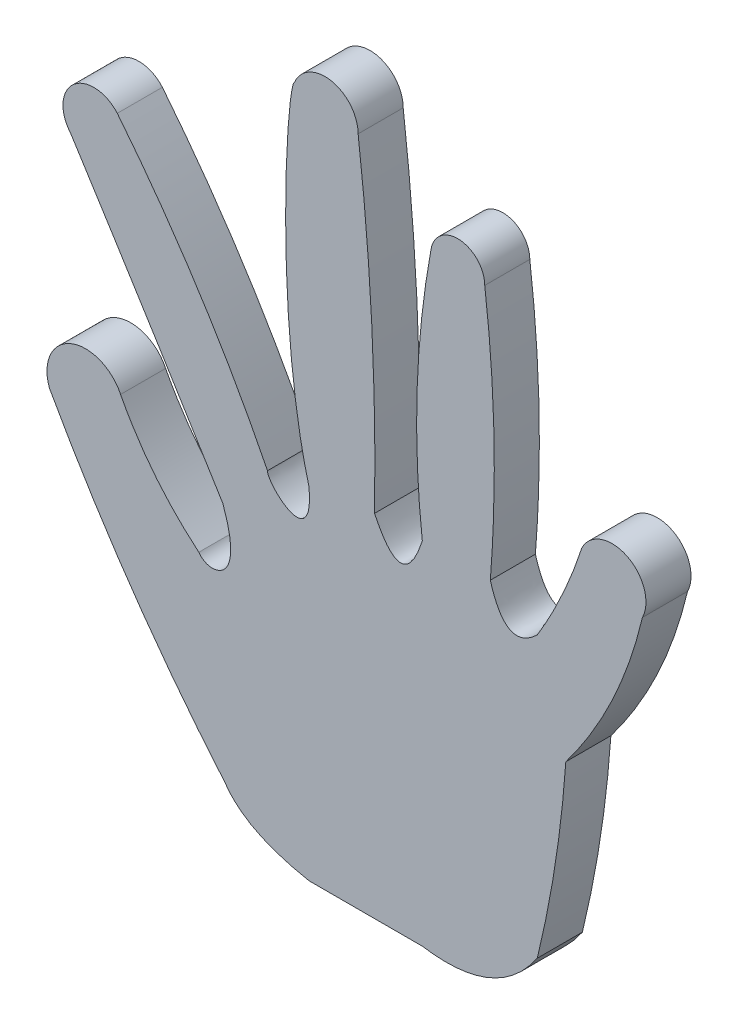
from build123d import *

# Parameters (mm, degrees)
SALIENTE_EXTRUIR2_DEPTH = 1000


with BuildPart() as part:
    # Croquis1 → Saliente-Extruir2 (new body)
    with BuildSketch(Plane.XY):
        with BuildLine():
            add(Edge.make_bspline(
                [(-3529.51384395, -1202.233467952), (-1856.037352978, -4219.223232207), (379.87956173, -6850.526052201)],
                knots=[0, 0, 0, 1, 1, 1], degree=2))
            Line((379.87956173, -6850.526052201), (395.792572055, -6873.329985392))
            add(Edge.make_bspline(
                [(2230.703376721, -7786.815055438), (862.593094055, -7527.652453331), (395.792572055, -6873.329985392)],
                knots=[0, 0, 0, 0.982960508, 0.982960508, 0.982960508], degree=2))
            Line((2230.703376721, -7786.815055438), (4743.053831113, -7786.815055438))
            add(Edge.make_bspline(
                [(7294.057713376, -6741.772668763), (6406.517718068, -8048.244997382), (4743.053831113, -7786.815055438)],
                knots=[0, 0, 0, 1, 1, 1], degree=2))
            add(Edge.make_bspline(
                [(7926.403518411, -2651.003443214), (7782.909975582, -4725.088301009), (7294.057713376, -6741.772668763)],
                knots=[0, 0, 0, 1, 1, 1], degree=2))
            add(Edge.make_bspline(
                [(9626.321129043, 970.777177928), (9151.24781504, -1031.315970782), (7926.403518411, -2651.003443214)],
                knots=[0, 0, 0, 1, 1, 1], degree=2))
            ThreePointArc((9626.321129043, 970.777177928), (9288.825480559, 1976.310214309), (8283.292444177, 1638.814565826))
            add(Edge.make_bspline(
                [(8283.292444177, 1638.814565826), (7913.681655155, 496.999655055), (7292.149119226, -532.552706313)],
                knots=[0, 0, 0, 1, 1, 1], degree=2))
            add(Edge.make_bspline(
                [(7292.149119226, -532.552706313), (6599.095962995, -1196.63110018), (6251.694578753, 0)],
                knots=[0, 0, 0, 1, 1, 1], degree=2))
            add(Edge.make_bspline(
                [(6128.016784622, 5601.93212094), (6476.130264467, 2805.124465974), (6251.694578753, 0)],
                knots=[0, 0, 0, 1, 1, 1], degree=2))
            ThreePointArc((6128.016784622, 5601.93212094), (5581.64471986, 6199.530685666), (4937.603302748, 5708.758711365))
            add(Edge.make_bspline(
                [(4937.603302748, 5708.758711365), (4413.951962857, 2863.666849894), (4743.053831113, 0)],
                knots=[0, 0, 0, 1, 1, 1], degree=2))
            add(Edge.make_bspline(
                [(4743.053831113, 0), (4312.779053917, -1324.821383248), (3682.749977241, 0)],
                knots=[0, 0, 0, 1, 1, 1], degree=2))
            add(Edge.make_bspline(
                [(3318.777516252, 7110.100341624), (3746.251250024, 3568.224392724), (3682.749977241, 0)],
                knots=[0, 0, 0, 1, 1, 1], degree=2))
            ThreePointArc((3318.777516252, 7110.100341624), (2730.695177179, 7829.57571119), (1907.674772526, 7398.15589423))
            add(Edge.make_bspline(
                [(1907.674772526, 7398.15589423), (1727.374281104, 7282.699726861), (1453.82223485, 2643.683209052), (2230.703376721, -225.221152689)],
                knots=[0, 0, 0, 0, 1, 1, 1, 1], degree=3))
            add(Edge.make_bspline(
                [(2230.703376721, -225.221152689), (2353.623865165, -1570.04707712), (1307.535590584, -636.844625668), (1307.894403605, -368.14161135)],
                knots=[0, 0, 0, 0, 1, 1, 1, 1], degree=3))
            add(Edge.make_bspline(
                [(1307.894403605, -368.14161135), (-82.147377215, 2408.693638396), (-2024.334507479, 4833.611616382)],
                knots=[0, 0, 0, 1, 1, 1], degree=2))
            ThreePointArc((-2024.334507479, 4833.611616382), (-2992.159941905, 4904.5661391), (-3063.114464623, 3936.740704674))
            add(Edge.make_bspline(
                [(316.998012386, -1491.068073752), (-1349.216688817, 1237.70132277), (-3063.114464623, 3936.740704674)],
                knots=[0, 0, 0, 1, 1, 1], degree=2))
            add(Edge.make_bspline(
                [(316.998012386, -1491.068073752), (625.968743176, -2340.71628823), (389.719115296, -2690.682781105)],
                knots=[0, 0, 0, 0.430745702, 0.430745702, 0.430745702], degree=2))
            ThreePointArc((389.719115296, -2690.682781105), (88.024050835, -2852.52229192), (-216.138022944, -2695.368316294))
            add(Edge.make_bspline(
                [(-216.138022944, -2695.368316294), (-1298.906710721, -1787.836055316), (-1951.818132837, -532.552706313)],
                knots=[0, 0, 0, 1, 1, 1], degree=2))
            ThreePointArc((-1951.818132837, -532.552706313), (-3062.205881719, -109.87974688), (-3529.51384395, -1202.233467952))
        make_face()
    extrude(amount=SALIENTE_EXTRUIR2_DEPTH)


solid = part.part
